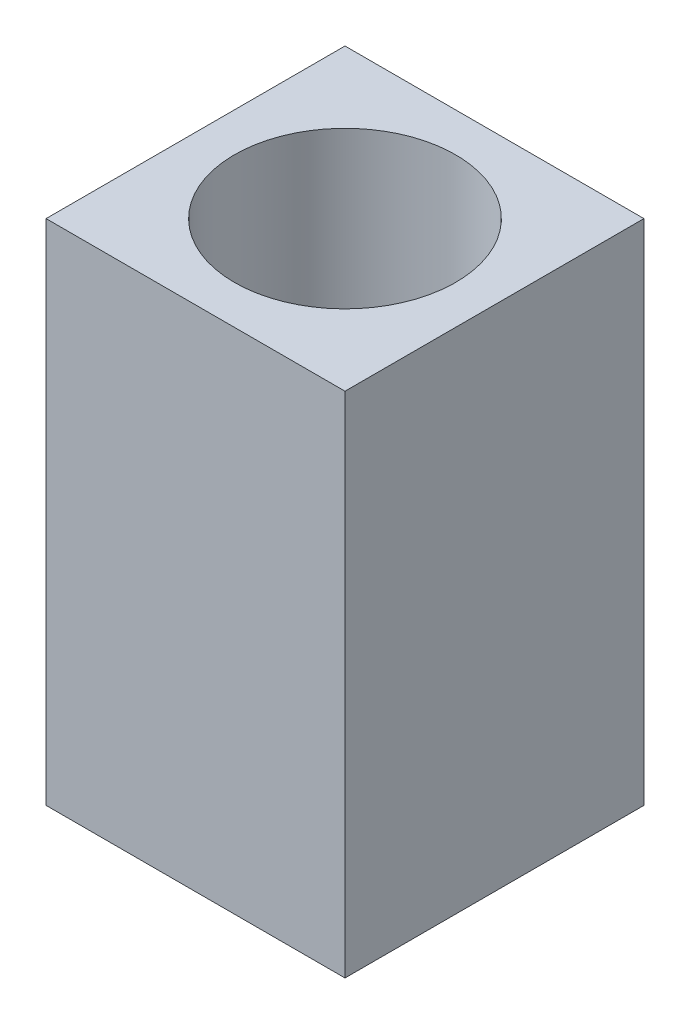
from build123d import *

# Parameters (mm, degrees)
SKETCH1_W           = 10
SKETCH1_H           = 10
BOSS_EXTRUDE1_DEPTH = 17
CUT_EXTRUDE1_DEPTH  = 17


with BuildPart() as part:
    # Sketch1 → Boss-Extrude1 (new body)
    with BuildSketch(Plane(origin=(0, 0, 0), x_dir=(1, 0, 0), z_dir=(0, 1, 0))):
        with Locations((5, 5)):
            Rectangle(SKETCH1_W, SKETCH1_H)
    extrude(amount=BOSS_EXTRUDE1_DEPTH)

    # Sketch2 → Cut-Extrude1 (cut)
    with BuildSketch(Plane(origin=(0, 17, 0), x_dir=(1, 0, 0), z_dir=(0, 1, 0))):
        with BuildLine():
            ThreePointArc((7.61629509, 7.61629509), (2.38370491, 7.61629509), (2.38370491, 2.38370491))
            Line((2.38370491, 2.38370491), (7.61629509, 7.61629509))
        make_face()
        with BuildLine():
            Line((7.61629509, 7.61629509), (2.38370491, 2.38370491))
            ThreePointArc((2.38370491, 2.38370491), (6.4159287, 1.58164573), (8.7, 5))
            ThreePointArc((8.7, 5), (8.41835427, 6.4159287), (7.61629509, 7.61629509))
        make_face()
    extrude(amount=-CUT_EXTRUDE1_DEPTH, mode=Mode.SUBTRACT)


solid = part.part
